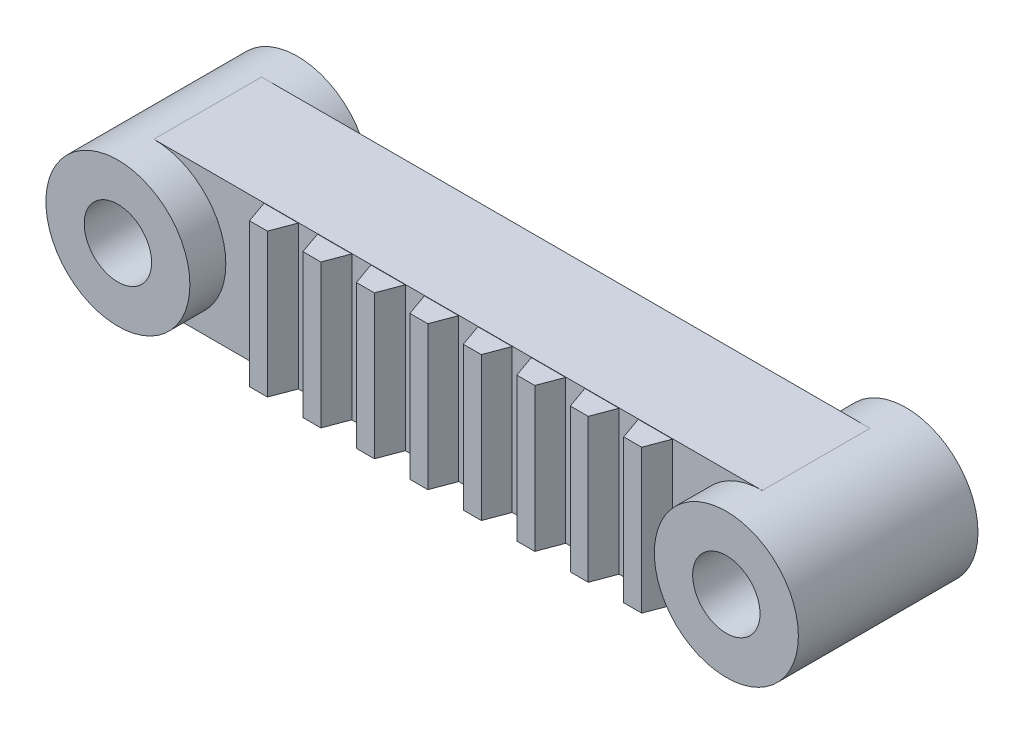
from build123d import *

# Parameters (mm, degrees)
SKETCH3_R             = 8017.882060266
SKETCH3_R_2           = 3750
BOSS_EXTRUDE1_DEPTH   = 20000
BOSS_EXTRUDE1_2_DEPTH = 20000
BOSS_EXTRUDE2_START   = 4000
BOSS_EXTRUDE2_DEPTH   = 12000
BOSS_EXTRUDE3_DEPTH   = 16000


with BuildPart() as part:
    # Sketch3 → Boss-Extrude1 (new body)
    with BuildSketch(Plane.XY):
        with Locations((-140288.944796633, 6867.007771622)):
            Circle(SKETCH3_R)
        with Locations((-140288.944796633, 6867.007771622)):
            Circle(SKETCH3_R_2, mode=Mode.SUBTRACT)
    extrude(amount=BOSS_EXTRUDE1_DEPTH)



with BuildPart() as body_2:
    # Sketch3 → Boss-Extrude1 2 (new body)
    with BuildSketch(Plane.XY):
        with Locations((-72550.864388804, 6867.007771622)):
            Circle(SKETCH3_R)
        with Locations((-72550.864388804, 6867.007771622)):
            Circle(SKETCH3_R_2, mode=Mode.SUBTRACT)
    extrude(amount=BOSS_EXTRUDE1_2_DEPTH)


with BuildPart() as part_1:
    add(part.part)

    add(body_2.part)  # Boss-Extrude2 merges body 2
    # Sketch4 → Boss-Extrude2 (add)
    with BuildSketch(Plane.XY.offset(BOSS_EXTRUDE2_START)):
        with BuildLine():
            Line((-72550.864388804, 14884.889831888), (-140288.944796633, 14884.889831888))
            ThreePointArc((-140288.944796633, 14884.889831888), (-132271.062736367, 6867.007771622), (-140288.944796633, -1150.874288644))
            Line((-140288.944796633, -1150.874288644), (-72550.864388804, -1150.874288644))
            ThreePointArc((-72550.864388804, -1150.874288644), (-80568.74644907, 6867.007771622), (-72550.864388804, 14884.889831888))
        make_face()
    extrude(amount=BOSS_EXTRUDE2_DEPTH)

    # Sketch6 → Boss-Extrude3 (add)
    with BuildSketch(Plane.XZ.offset(1150.874288644)):
        Polygon((-122067.508437156, 16000), (-118247.428096981, 16000), (-119187.323278513, 18500), (-121187.323278513, 18500), align=None)
        Polygon((-116115.100809082, 16000), (-112295.020468907, 16000), (-113234.915650439, 18500), (-115234.915650439, 18500), align=None)
        Polygon((-110162.693181009, 16000), (-106342.612840833, 16000), (-107282.508022365, 18500), (-109282.508022365, 18500), align=None)
        Polygon((-104210.285552935, 16000), (-100390.205212759, 16000), (-101330.100394292, 18500), (-103330.100394292, 18500), align=None)
        Polygon((-98257.877924861, 16000), (-94437.797584686, 16000), (-95377.692766218, 18500), (-97377.692766218, 18500), align=None)
        Polygon((-92305.470296787, 16000), (-88485.389956612, 16000), (-89425.285138144, 18500), (-91425.285138144, 18500), align=None)
        Polygon((-85472.87751007, 18500), (-86353.062668713, 16000), (-82532.982328538, 16000), (-83472.87751007, 18500), align=None)
        Polygon((-128019.91606523, 16000), (-127139.730906587, 18500), (-125139.730906587, 18500), (-124199.835725055, 16000), align=None)
    extrude(amount=-BOSS_EXTRUDE3_DEPTH)


solid = part_1.part
